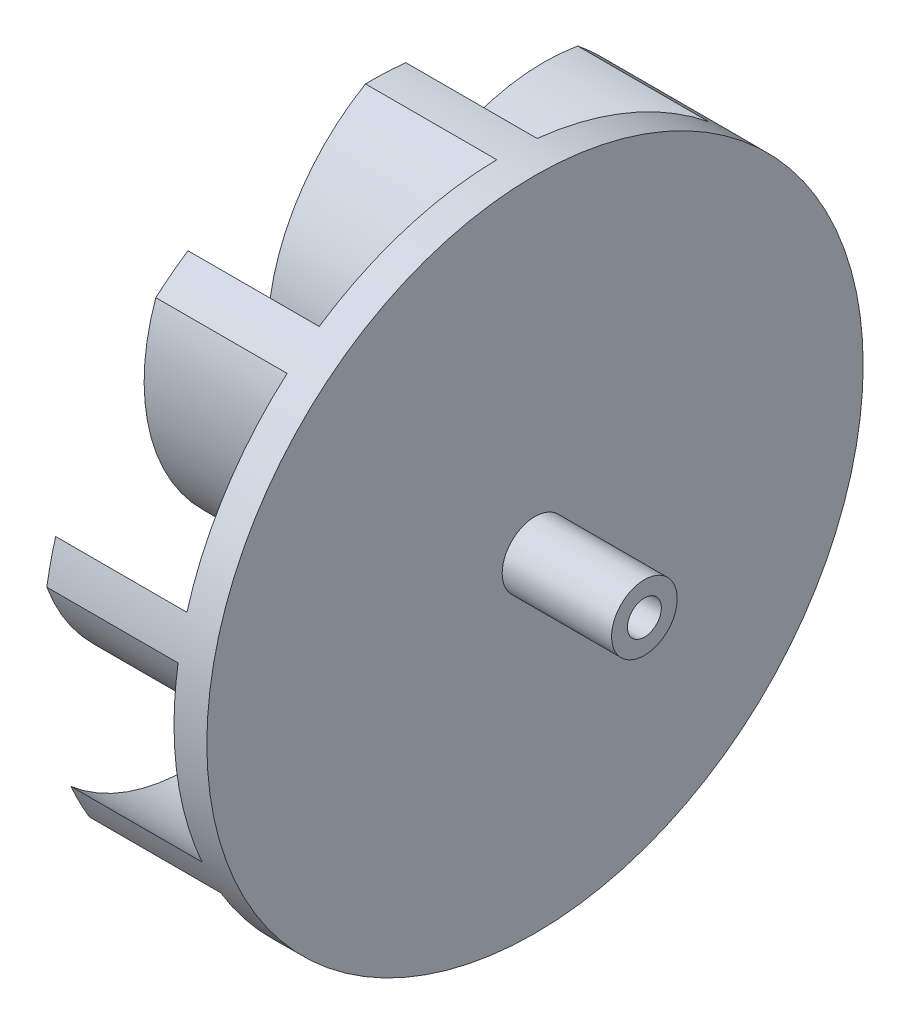
from build123d import *

# Parameters (mm, degrees)
SKETCH4_R           = 3
BOSS_EXTRUDE2_DEPTH = 10
SKETCH5_R           = 1.55
CUT_EXTRUDE1_DEPTH  = 11.4
BOSS_EXTRUDE3_START = 12
BOSS_EXTRUDE3_DEPTH = 12
CIRPATTERN2_COUNT   = 9


with BuildPart() as part:
    # Sketch1 → Revolve1 (revolve)
    with BuildSketch(Plane(origin=(0, 0, 0), x_dir=(1, 0, 0), z_dir=(0, 1, 0)), mode=Mode.PRIVATE) as revolve1_sk:
        with BuildLine():
            Line((0, 0), (0, 30))
            Line((0, 30), (-3, 30))
            Line((-3, 30), (-3, 5))
            Line((-3, 5), (-8, 5))
            ThreePointArc((-8, 5), (-10.828427125, 3.828427125), (-12, 1))
            Line((-12, 1), (-12, 0))
            Line((-12, 0), (0, 0))
        make_face()
    revolve(revolve1_sk.sketch.rotate(Axis((-12, 0, 0), (1, 0, 0)), 180), axis=Axis((-12, 0, 0), (1, 0, 0)))

    # Sketch4 → Boss-Extrude2 (add)
    with BuildSketch(Plane(origin=(0, 0, 0), x_dir=(0, 0, -1), z_dir=(1, 0, 0))):
        with Locations(Location((0, 0, 0), (0, 0, 180))):
            Circle(SKETCH4_R)
    extrude(amount=BOSS_EXTRUDE2_DEPTH)

    # Sketch5 → Cut-Extrude1 (cut)
    with BuildSketch(Plane(origin=(10, 0, 0), x_dir=(0, 0, -1), z_dir=(1, 0, 0))):
        Circle(SKETCH5_R)
    extrude(amount=-CUT_EXTRUDE1_DEPTH, mode=Mode.SUBTRACT)

    # Sketch6 → Boss-Extrude3 (add)
    with BuildSketch(Plane.ZY.offset(3).offset(BOSS_EXTRUDE3_START)):
        with BuildLine():
            ThreePointArc((8.265556015, 7.995660308), (7.604078802, 8.627165559), (6.89451328, 9.204112485))
            ThreePointArc((6.89451328, 9.204112485), (6.09737327, 21.594864355), (-3.195635958, 29.829312946))
            ThreePointArc((-3.195635958, 29.829312946), (-1.351457872, 29.969543901), (0.497856742, 29.995868693))
            ThreePointArc((0.497856742, 29.995868693), (8.428709352, 20.424655605), (8.265556015, 7.995660308))
        make_face()
    boss_extrude3 = extrude(amount=-BOSS_EXTRUDE3_DEPTH)

    # CirPattern2: Boss-Extrude3 ×9 about axis
    cirpattern2_axis = Axis((0, 0, 0), (1, 0, 0))
    for i in range(1, CIRPATTERN2_COUNT):
        add(boss_extrude3.rotate(cirpattern2_axis, i * 360 / CIRPATTERN2_COUNT))


solid = part.part
